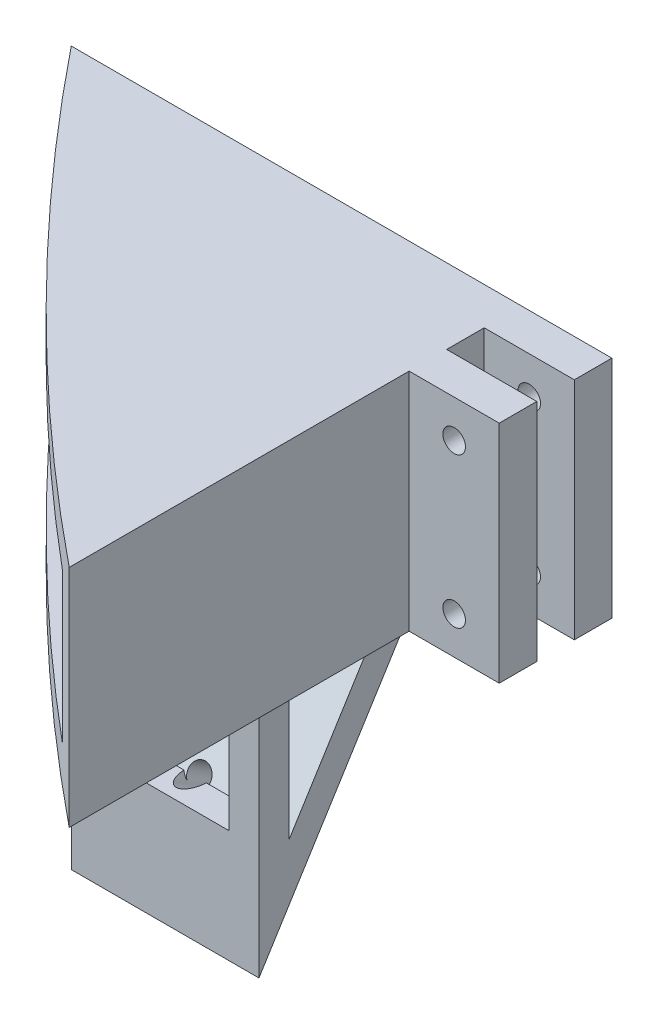
from build123d import *

# Parameters (mm, degrees)
EXTRUDE_1_DEPTH          = 30
CUT_EXTRUDE_1_DEPTH      = 98.124713642
CUT_EXTRUDE_1_DEPTH_BACK = 98.124713642
SKETCH_2_R               = 1.5
CUT_EXTRUDE_6_DEPTH      = 10
EXTRUDE_3_DEPTH          = 12.5
SKETCH_12_W              = 5
SKETCH_12_H              = 30
EXTRUDE_4_DEPTH          = 2
SKETCH_17_W              = 25
SKETCH_17_H              = 25
EXTRUDE_7_DEPTH          = 40
CUT_EXTRUDE_9_DEPTH      = 50
SKETCH_21_R              = 1.5
CUT_EXTRUDE_12_DEPTH     = 7
CUT_EXTRUDE_13_DEPTH     = 500
SKETCH_23_W              = 17
SKETCH_23_H              = 21
CUT_EXTRUDE_14_DEPTH     = 4


with BuildPart() as part:
    # 草图1 → 凸台-拉伸1 (new body)
    with BuildSketch(Plane(origin=(0, 0, 0), x_dir=(1, 0, 0), z_dir=(0, 1, 0))):
        with BuildLine():
            Line((0, 0), (-70, 0))
            ThreePointArc((-70, 0), (-41.606545869, -31.737243891), (-10, -60.276114672))
            Line((-10, -60.276114672), (-10, -15))
            Line((-10, -15), (0, -15))
            Line((0, -15), (0, -10))
            Line((0, -10), (-10, -10))
            Line((-10, -10), (-10, -5))
            Line((-10, -5), (0, -5))
            Line((0, -5), (0, 0))
        make_face()
    extrude(amount=EXTRUDE_1_DEPTH)

    # 草图2 → 切除-拉伸1 (cut, two sides: drawn at the far end of the back side and taken through both)
    with BuildSketch(Plane(origin=(0, 0, 0), x_dir=(-1, 0, 0), z_dir=(0, 0, -1)).offset(-CUT_EXTRUDE_1_DEPTH_BACK)):
        with Locations((4, 25)):
            Circle(SKETCH_2_R)
        with Locations((4, 5)):
            Circle(SKETCH_2_R)
    extrude(amount=CUT_EXTRUDE_1_DEPTH + CUT_EXTRUDE_1_DEPTH_BACK, mode=Mode.SUBTRACT)

    # 草图9 → 切除-拉伸6 (cut, symmetric)
    with BuildSketch(Plane(origin=(0, 15, 0), x_dir=(1, 0, 0), z_dir=(0, 1, 0))):
        with BuildLine():
            Line((-65.918016471, -5), (-59.391772218, -5))
            Line((-59.391772218, -5), (-15, -5))
            Line((-15, -5), (-15, -15))
            Line((-15, -15), (-15, -49.60330608))
            Line((-15, -49.60330608), (-15, -56.155472209))
            ThreePointArc((-15, -56.155472209), (-41.615194331, -31.728555364), (-65.918016471, -5))
        make_face()
    extrude(amount=CUT_EXTRUDE_6_DEPTH, both=True, mode=Mode.SUBTRACT)

    # 草图11 → 凸台-拉伸3 (add, symmetric)
    with BuildSketch(Plane(origin=(0, 15, 0), x_dir=(1, 0, 0), z_dir=(0, 1, 0))):
        Polygon((-15, -5), (-23, -5), (-15, -10), align=None)
    extrude(amount=EXTRUDE_3_DEPTH, both=True)

    # 草图12 → 凸台-拉伸4 (add)
    with BuildSketch(Plane(origin=(0, 0, 0), x_dir=(0, 0, -1), z_dir=(1, 0, 0))):
        with Locations((-12.5, 15)):
            Rectangle(SKETCH_12_W, SKETCH_12_H)
        with Locations((-2.5, 15)):
            Rectangle(SKETCH_12_W, SKETCH_12_H)
    extrude(amount=EXTRUDE_4_DEPTH)

    # 草图17 → 凸台-拉伸7 (add)
    with BuildSketch(Plane.XZ):
        with Locations((-32.5, 12.5)):
            Rectangle(SKETCH_17_W, SKETCH_17_H)
    extrude(amount=EXTRUDE_7_DEPTH)

    # 草图18 → 切除-拉伸9 (cut)
    with BuildSketch(Plane.ZY.offset(45)):
        Polygon((0, 0), (25, -40), (0, -40), align=None)
    extrude(amount=-CUT_EXTRUDE_9_DEPTH, mode=Mode.SUBTRACT)

    # 草图21 → 切除-拉伸12 (cut)
    with BuildSketch(Plane(origin=(0, 0, 0), x_dir=(-1, 0, 0), z_dir=(0, -0.52999894000318, -0.8479983040050879))):
        with Locations(Location((32.5, -22.16990566, 0), (0, 0, 90))):
            Circle(SKETCH_21_R)
        with Locations(Location((32.5, -12.16990566, 0), (0, 0, 90))):
            Circle(SKETCH_21_R)
        with Locations(Location((32.5, -32.16990566, 0), (0, 0, 90))):
            Circle(SKETCH_21_R)
    extrude(amount=-CUT_EXTRUDE_12_DEPTH, mode=Mode.SUBTRACT)

    # 草图22 → 切除-拉伸13 (cut)
    with BuildSketch(Plane.ZY.offset(45)):
        Polygon((7.216990566, -4), (21, -4), (21, -26.052815094), align=None)
    extrude(amount=-CUT_EXTRUDE_13_DEPTH, mode=Mode.SUBTRACT)

    # 草图23 → 切除-拉伸14 (cut)
    with BuildSketch(Plane.XY.offset(25)):
        with Locations((-32.5, -14.5)):
            Rectangle(SKETCH_23_W, SKETCH_23_H)
    extrude(amount=-CUT_EXTRUDE_14_DEPTH, mode=Mode.SUBTRACT)


solid = part.part
